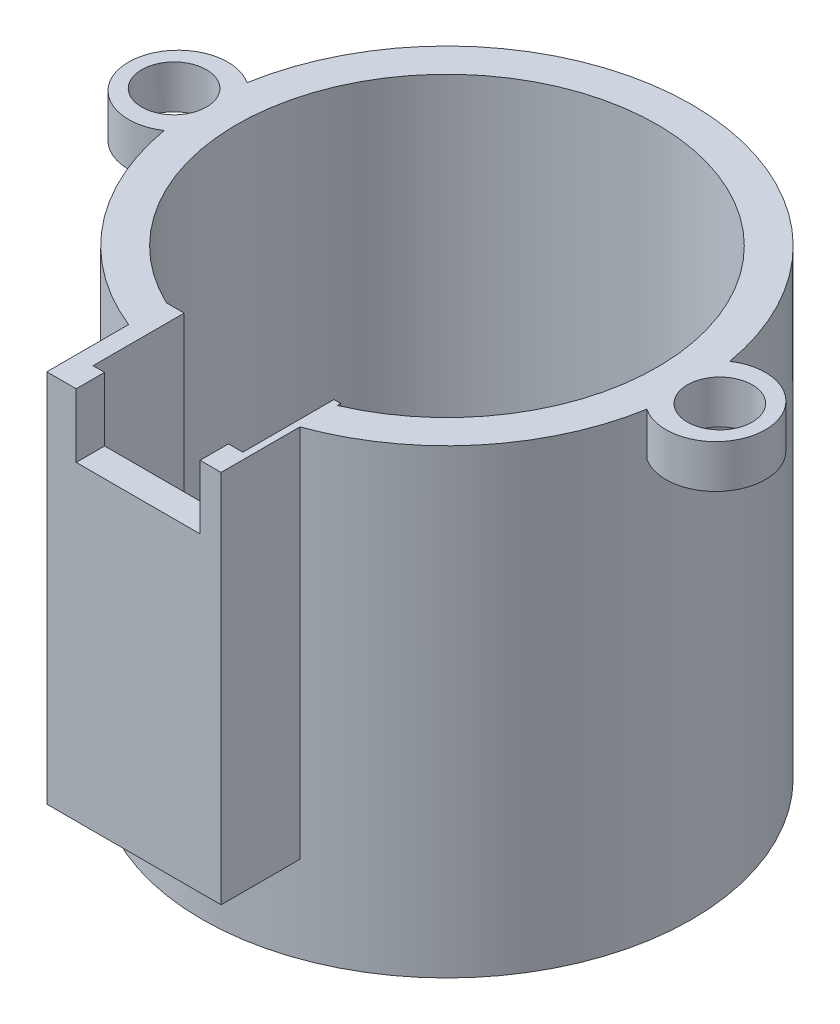
from build123d import *

# Parameters (mm, degrees)
SKETCH1_R           = 17
BOSS_EXTRUDE1_DEPTH = 32
SHELL1_T            = -2.4
SKETCH2_R           = 3.45
BOSS_EXTRUDE3_DEPTH = 3
SKETCH4_R           = 2.25
CUT_EXTRUDE1_DEPTH  = 3
SKETCH5_W           = 12.1
SKETCH5_H           = 8.3
BOSS_EXTRUDE4_DEPTH = 26
SKETCH6_W           = 10.4
SKETCH6_H           = 8.6
CUT_EXTRUDE2_DEPTH  = 25
SKETCH7_W           = 8.6
SKETCH7_H           = 5.8
CUT_EXTRUDE3_DEPTH  = 5


with BuildPart() as part:
    # Sketch1 → Boss-Extrude1 (new body)
    with BuildSketch(Plane(origin=(0, 0, 0), x_dir=(1, 0, 0), z_dir=(0, 1, 0))):
        with Locations(Location((0, 0, 0), (0, 0, 270))):
            Circle(SKETCH1_R)
    extrude(amount=BOSS_EXTRUDE1_DEPTH)

    # Shell1
    shell1_openings = [part.faces().sort_by_distance(p)[0] for p in [
        (0, 32, 0),
    ]]
    offset(amount=SHELL1_T, openings=shell1_openings, kind=Kind.INTERSECTION)

    # Sketch2 → Boss-Extrude3 (add)
    with BuildSketch(Plane(origin=(0, 32, 0), x_dir=(1, 0, 0), z_dir=(0, 1, 0))):
        with Locations((18.659372003, 0)):
            Circle(SKETCH2_R)
        with Locations((-18.659372003, 0)):
            Circle(SKETCH2_R)
    extrude(amount=-BOSS_EXTRUDE3_DEPTH)

    # Sketch4 → Cut-Extrude1 (cut)
    with BuildSketch(Plane(origin=(0, 32, 0), x_dir=(1, 0, 0), z_dir=(0, 1, 0))):
        with Locations(Location((18.946509427, 0, 0), (0, 0, 270))):
            Circle(SKETCH4_R)
        with Locations(Location((-18.946509427, 0, 0), (0, 0, 331.648790534))):
            Circle(SKETCH4_R)
    extrude(amount=-CUT_EXTRUDE1_DEPTH, mode=Mode.SUBTRACT)

    # Sketch5 → Boss-Extrude4 (add)
    with BuildSketch(Plane(origin=(0, 32, 0), x_dir=(1, 0, 0), z_dir=(0, 1, 0))):
        with Locations((-0.271875844, -17.310314807)):
            Rectangle(SKETCH5_W, SKETCH5_H)
    extrude(amount=-BOSS_EXTRUDE4_DEPTH)

    # Sketch6 → Cut-Extrude2 (cut)
    with BuildSketch(Plane(origin=(0, 32, 0), x_dir=(1, 0, 0), z_dir=(0, 1, 0))):
        with Locations((0.116623003, -15.189562959)):
            Rectangle(SKETCH6_W, SKETCH6_H)
    extrude(amount=-CUT_EXTRUDE2_DEPTH, mode=Mode.SUBTRACT)

    # Sketch7 → Cut-Extrude3 (cut)
    with BuildSketch(Plane.XY.offset(21.460314807)):
        with Locations((0.019518241, 30.472573952)):
            Rectangle(SKETCH7_W, SKETCH7_H)
    extrude(amount=-CUT_EXTRUDE3_DEPTH, mode=Mode.SUBTRACT)


solid = part.part
